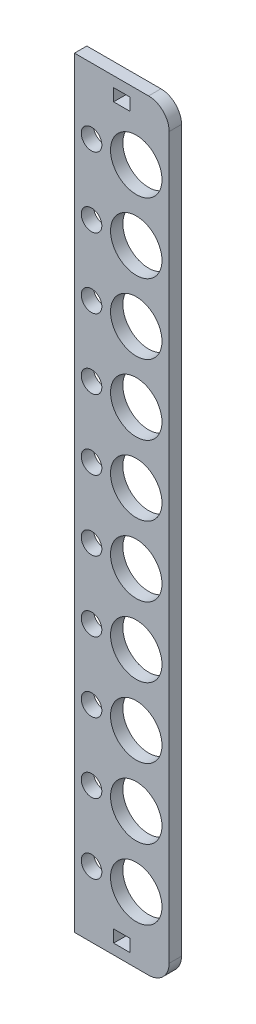
from build123d import *

# Parameters (mm, degrees)
ESQUISSE1_W             = 46
ESQUISSE1_H             = 370
ESQUISSE1_W_2           = 8
ESQUISSE1_H_2           = 6
BOSS_EXTRU_1_DEPTH      = 6
ESQUISSE2_R             = 12.5
ESQUISSE2_R_2           = 5
ENL_V_MAT_EXTRU_1_DEPTH = 6
CONG_1_R                = 10


with BuildPart() as part:
    # Esquisse1 → Boss.-Extru.1 (new body)
    with BuildSketch(Plane.XY):
        with Locations((23, 185)):
            Rectangle(ESQUISSE1_W, ESQUISSE1_H)
        with Locations((23, 8)):
            Rectangle(ESQUISSE1_W_2, ESQUISSE1_H_2, mode=Mode.SUBTRACT)
        with Locations((23, 362)):
            Rectangle(ESQUISSE1_W_2, ESQUISSE1_H_2, mode=Mode.SUBTRACT)
    extrude(amount=BOSS_EXTRU_1_DEPTH)

    # Esquisse2 → Enlèv. mat.-Extru.1 (cut)
    with BuildSketch(Plane.XY.offset(6)):
        with Locations((30, 32)):
            Circle(ESQUISSE2_R)
        with Locations((30, 66)):
            Circle(ESQUISSE2_R)
        with Locations((30, 100)):
            Circle(ESQUISSE2_R)
        with Locations((30, 134)):
            Circle(ESQUISSE2_R)
        with Locations((30, 168)):
            Circle(ESQUISSE2_R)
        with Locations((30, 202)):
            Circle(ESQUISSE2_R)
        with Locations((30, 236)):
            Circle(ESQUISSE2_R)
        with Locations((30, 270)):
            Circle(ESQUISSE2_R)
        with Locations((30, 304)):
            Circle(ESQUISSE2_R)
        with Locations((8.281143203, 338)):
            Circle(ESQUISSE2_R_2)
        with Locations((8.281143203, 304)):
            Circle(ESQUISSE2_R_2)
        with Locations((8.281143203, 270)):
            Circle(ESQUISSE2_R_2)
        with Locations((8.281143203, 236)):
            Circle(ESQUISSE2_R_2)
        with Locations((8.281143203, 202)):
            Circle(ESQUISSE2_R_2)
        with Locations((8.281143203, 168)):
            Circle(ESQUISSE2_R_2)
        with Locations((8.281143203, 134)):
            Circle(ESQUISSE2_R_2)
        with Locations((8.281143203, 100)):
            Circle(ESQUISSE2_R_2)
        with Locations((8.281143203, 66)):
            Circle(ESQUISSE2_R_2)
        with Locations((30, 338)):
            Circle(ESQUISSE2_R)
        with Locations((8.281143203, 32)):
            Circle(ESQUISSE2_R_2)
    extrude(amount=-ENL_V_MAT_EXTRU_1_DEPTH, mode=Mode.SUBTRACT)

    # Congé1
    cong_1_edges = [part.edges().sort_by_distance(p)[0] for p in [
        (46, 370, 3),
        (46, 0, 3),
    ]]
    fillet(cong_1_edges, radius=CONG_1_R)


solid = part.part
